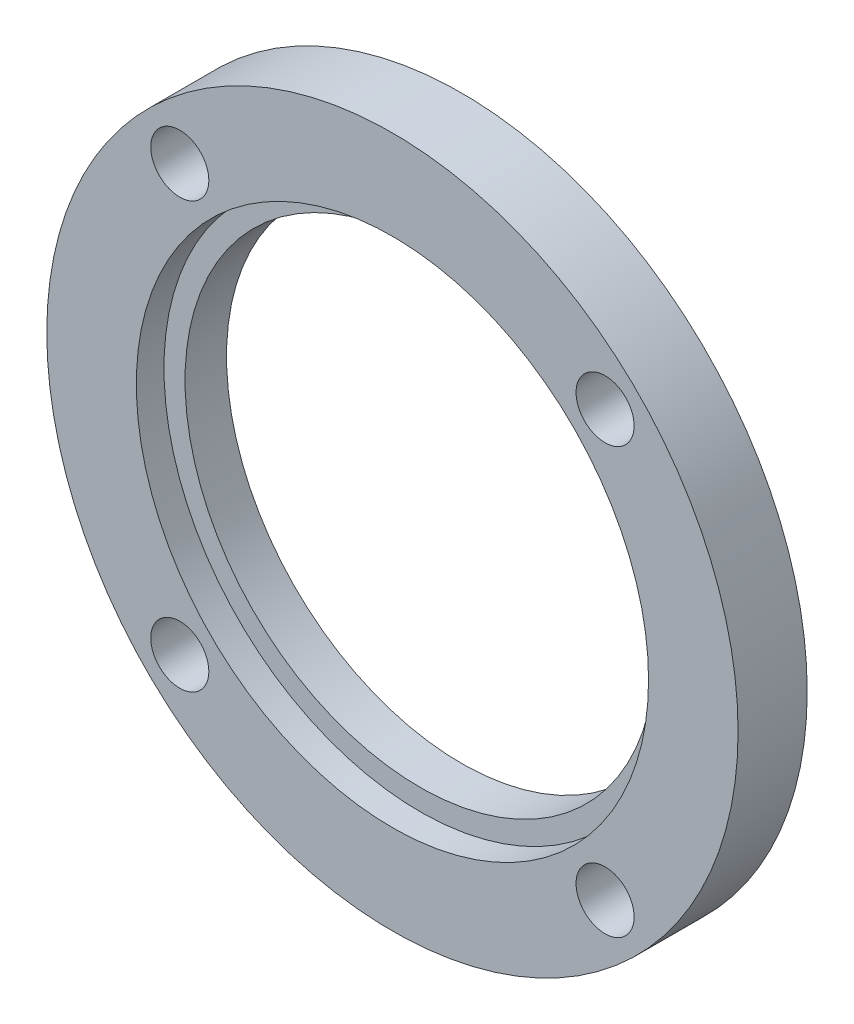
from build123d import *

# Parameters (mm, degrees)
SKETCH_1_R          = 25
EXTRUDE_1_DEPTH     = 5
SKETCH_2_R          = 18.525
CUT_EXTRUDE_1_DEPTH = 2
SKETCH_3_R          = 17
CUT_EXTRUDE_2_DEPTH = 3
SKETCH_4_R          = 2.1
CUT_EXTRUDE_3_DEPTH = 5


with BuildPart() as part:
    # ｽｹｯﾁ1 → ﾎﾞｽ - 押し出し1 (new body)
    with BuildSketch(Plane.XY):
        Circle(SKETCH_1_R)
    extrude(amount=EXTRUDE_1_DEPTH)

    # ｽｹｯﾁ2 → ｶｯﾄ - 押し出し1 (cut)
    with BuildSketch(Plane.XY.offset(5)):
        Circle(SKETCH_2_R)
    extrude(amount=-CUT_EXTRUDE_1_DEPTH, mode=Mode.SUBTRACT)

    # ｽｹｯﾁ3 → ｶｯﾄ - 押し出し2 (cut)
    with BuildSketch(Plane.XY.offset(3)):
        Circle(SKETCH_3_R)
    extrude(amount=-CUT_EXTRUDE_2_DEPTH, mode=Mode.SUBTRACT)

    # ｽｹｯﾁ4 → ｶｯﾄ - 押し出し3 (cut)
    with BuildSketch(Plane.XY.offset(5)):
        with Locations((15.379572491, 15.379572491)):
            Circle(SKETCH_4_R)
        with Locations((15.379572491, -15.379572491)):
            Circle(SKETCH_4_R)
        with Locations((-15.379572491, -15.379572491)):
            Circle(SKETCH_4_R)
        with Locations((-15.379572491, 15.379572491)):
            Circle(SKETCH_4_R)
    extrude(amount=-CUT_EXTRUDE_3_DEPTH, mode=Mode.SUBTRACT)


solid = part.part
